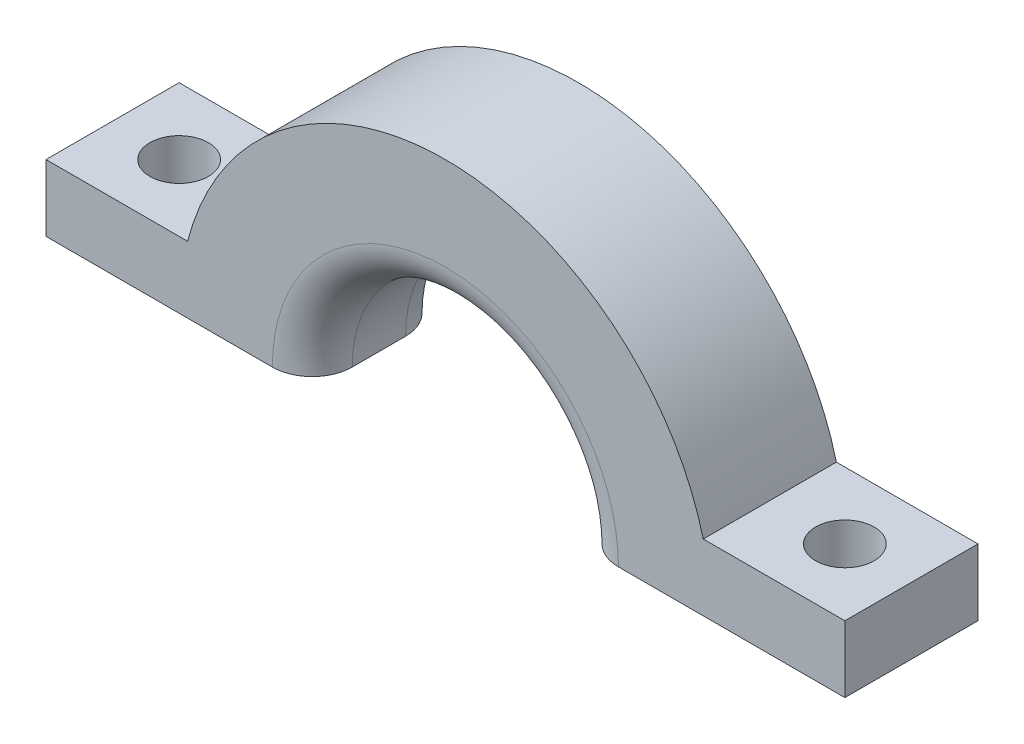
from build123d import *

# Parameters (mm, degrees)
REVOLVE1_ANGLE      = 180
SKETCH2_R           = 2.2
BOSS_EXTRUDE1_DEPTH = 5


with BuildPart() as part:
    # Sketch1 → Revolve1 (revolve)
    with BuildSketch(Plane(origin=(0, 0, 0), x_dir=(1, 0, 0), z_dir=(0, 1, 0))):
        with BuildLine():
            Line((-20, 0), (-13, 0))
            ThreePointArc((-13, 0), (-10.878679656, 0.878679656), (-10, 3))
            Line((-10, 3), (-10, 7))
            ThreePointArc((-10, 7), (-10.878679656, 9.121320344), (-13, 10))
            Line((-13, 10), (-20, 10))
            Line((-20, 10), (-20, 0))
        make_face()
    revolve(axis=Axis((0, 0, 0), (0, 0, -1)), revolution_arc=REVOLVE1_ANGLE)

    # Sketch2 → Boss-Extrude1 (add)
    # profile 1 of 2: a face of its own
    with BuildSketch(Plane.XZ):
        Polygon((-20, 0), (-30, 0), (-30, -10), (-20, -10), (-16.5, -10), (-16.5, 0), align=None)
        with Locations(Location((-25, -5, 0), (0, 0, 270))):
            Circle(SKETCH2_R, mode=Mode.SUBTRACT)
    # profile 2 of 2: a face of its own
    with BuildSketch(Plane.XZ):
        Polygon((20, 0), (30, 0), (30, -10), (20, -10), (16.5, -10), (16.5, 0), align=None)
        with Locations(Location((25, -5, 0), (0, 0, 270))):
            Circle(SKETCH2_R, mode=Mode.SUBTRACT)
    extrude(amount=-BOSS_EXTRUDE1_DEPTH)


solid = part.part
